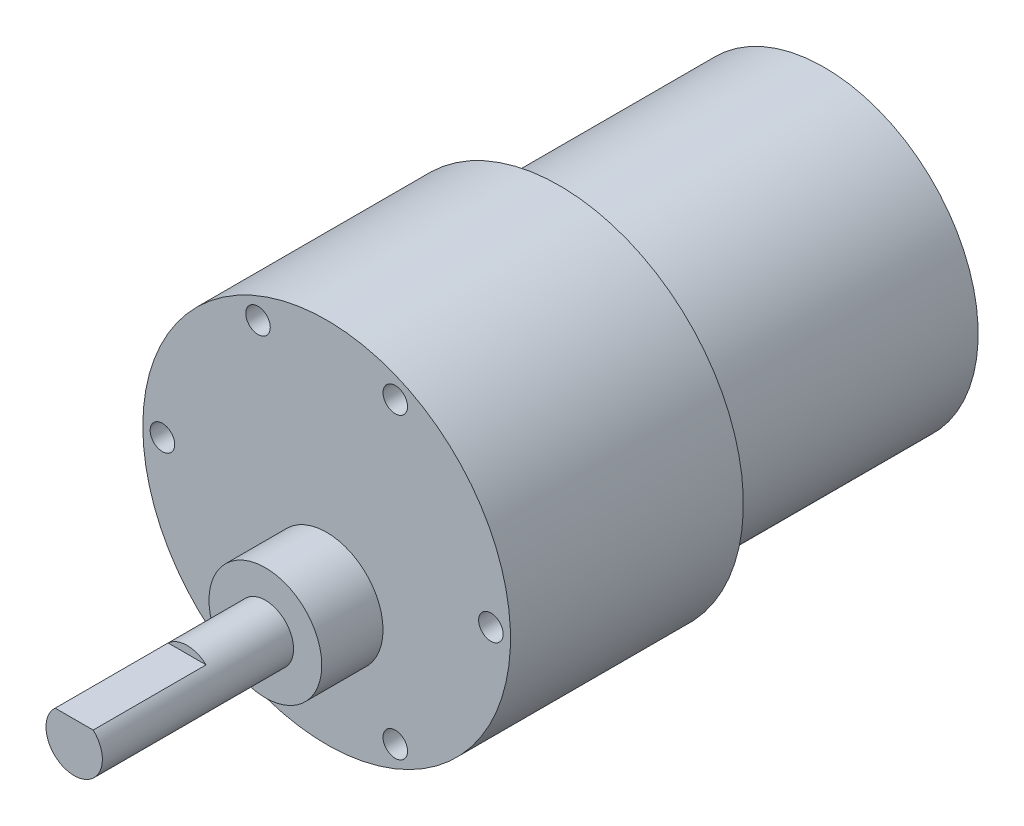
from build123d import *

# Parameters (mm, degrees)
SKETCH1_R           = 19.05
BOSS_EXTRUDE1_DEPTH = 24.13
SKETCH2_R           = 15.949999977
BOSS_EXTRUDE2_DEPTH = 27.432
SKETCH3_R           = 5.842
BOSS_EXTRUDE3_DEPTH = 6.35
SKETCH4_R           = 2.921
BOSS_EXTRUDE4_DEPTH = 19.812
SKETCH5_W           = 3.93495108
SKETCH5_H           = 0.762
CUT_EXTRUDE1_DEPTH  = 11.699999968
SKETCH6_R           = 1.27
CUT_EXTRUDE2_DEPTH  = 3.302


with BuildPart() as part:
    # Sketch1 → Boss-Extrude1 (new body)
    with BuildSketch(Plane.XY):
        with Locations(Location((0, 0, 0), (0, 0, 180))):
            Circle(SKETCH1_R)
    extrude(amount=BOSS_EXTRUDE1_DEPTH)

    # Sketch3 → Boss-Extrude3 (add)
    with BuildSketch(Plane.XY.offset(24.13)):
        with Locations((0, -5.842)):
            Circle(SKETCH3_R)
    extrude(amount=BOSS_EXTRUDE3_DEPTH)

    # Sketch4 → Boss-Extrude4 (add)
    with BuildSketch(Plane.XY.offset(30.48)):
        with Locations((0, -5.842)):
            Circle(SKETCH4_R)
    extrude(amount=BOSS_EXTRUDE4_DEPTH)

    # Sketch5 → Cut-Extrude1 (cut)
    with BuildSketch(Plane.XY.offset(50.292)):
        with Locations((0, -3.302)):
            Rectangle(SKETCH5_W, SKETCH5_H)
    extrude(amount=-CUT_EXTRUDE1_DEPTH, mode=Mode.SUBTRACT)

    # Sketch6 → Cut-Extrude2 (cut)
    with BuildSketch(Plane.XY.offset(24.13)):
        with Locations((-7.112, 15.460652638)):
            Circle(SKETCH6_R)
        with Locations((-7.112, -15.460652638)):
            Circle(SKETCH6_R)
        with Locations((-17.018, 0)):
            Circle(SKETCH6_R)
        with Locations((7.112, 15.460652638)):
            Circle(SKETCH6_R)
        with Locations((7.112, -15.460652638)):
            Circle(SKETCH6_R)
        with Locations((17.018, 0)):
            Circle(SKETCH6_R)
    extrude(amount=-CUT_EXTRUDE2_DEPTH, mode=Mode.SUBTRACT)


with BuildPart() as body_2:
    # Sketch2 → Boss-Extrude2 (new body)
    with BuildSketch(Plane(origin=(0, 0, 0), x_dir=(-1, 0, 0), z_dir=(0, 0, -1))):
        Circle(SKETCH2_R)
    extrude(amount=BOSS_EXTRUDE2_DEPTH)


solid = Compound([part.part, body_2.part])
